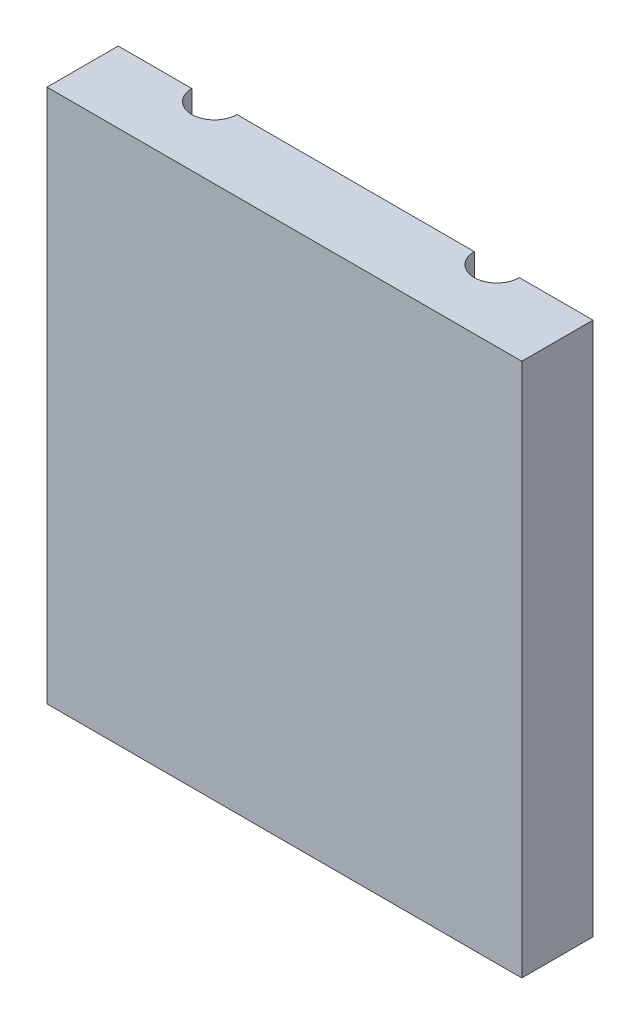
from build123d import *

# Parameters (mm, degrees)
SKETCH1_W          = 40
SKETCH1_H          = 45
BASE_DEPTH         = 6
WIRE_GROOVES_DEPTH = 50.608467019


with BuildPart() as part:
    # Sketch1 → Base (new body)
    with BuildSketch(Plane.XY):
        Rectangle(SKETCH1_W, SKETCH1_H)
    extrude(amount=BASE_DEPTH)

    # Sketch2 → Wire Grooves (cut, through all)
    with BuildSketch(Plane(origin=(0, 22.5, 0), x_dir=(1, 0, 0), z_dir=(0, 1, 0))):
        with BuildLine():
            Line((-13.8, 0), (-10, 0))
            ThreePointArc((-10, 0), (-11.9, -1.9), (-13.8, 0))
        make_face()
        with BuildLine():
            Line((13.8, 0), (10, 0))
            ThreePointArc((10, 0), (11.9, -1.9), (13.8, 0))
        make_face()
    extrude(amount=-WIRE_GROOVES_DEPTH, mode=Mode.SUBTRACT)


solid = part.part
